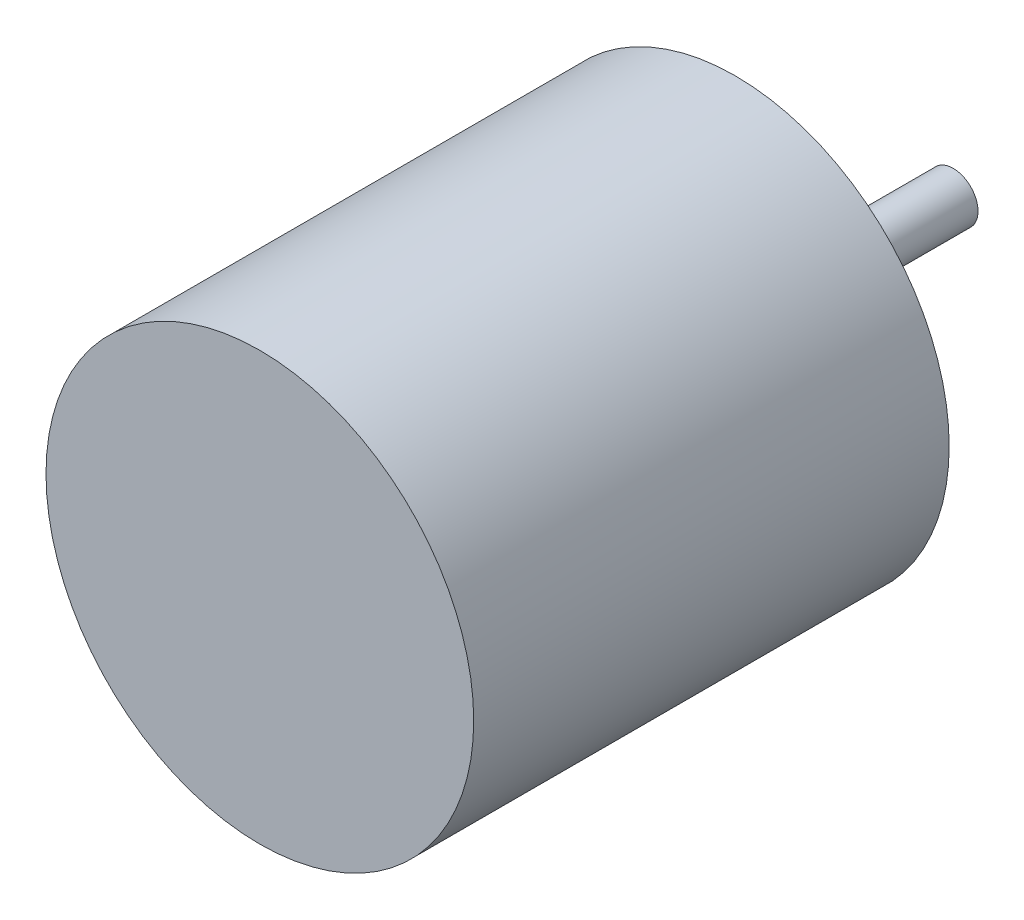
from build123d import *

# Parameters (mm, degrees)
SKETCH1_R           = 21.59
BOSS_EXTRUDE1_DEPTH = 48.000000012
SKETCH2_R           = 2.499995
BOSS_EXTRUDE2_DEPTH = 21.999999942


with BuildPart() as part:
    # Sketch1 → Boss-Extrude1 (new body)
    with BuildSketch(Plane.XY):
        Circle(SKETCH1_R)
    extrude(amount=BOSS_EXTRUDE1_DEPTH)

    # Sketch2 → Boss-Extrude2 (add)
    with BuildSketch(Plane(origin=(0, 0, 0), x_dir=(-1, 0, 0), z_dir=(0, 0, -1))):
        with Locations(Location((0, 0, 0), (0, 0, 180))):
            Circle(SKETCH2_R)
    extrude(amount=BOSS_EXTRUDE2_DEPTH)


solid = part.part
